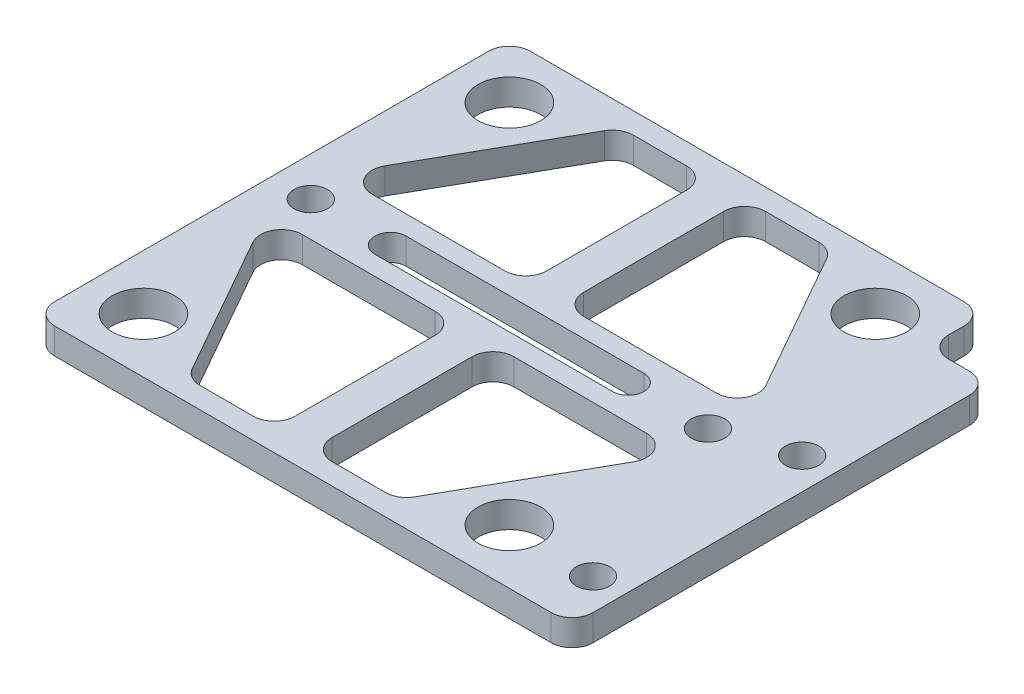
from build123d import *

# Parameters (mm, degrees)
SKETCH_1_W          = 45.5
SKETCH_1_H          = 45.5
SKETCH_1_R          = 3
EXTRUDE_1_DEPTH     = 2.5
SKETCH_2_W          = 6
SKETCH_2_H          = 40
SKETCH_2_R          = 1.6
EXTRUDE_2_DEPTH     = 2.5
FILLET_1_R          = 2
CUT_EXTRUDE_1_DEPTH = 37.747448891
FILLET_2_R          = 2
SKETCH_4_R          = 1.6
CUT_EXTRUDE_2_DEPTH = 37.747448891


with BuildPart() as part:
    # 草图1 → 凸台-拉伸1 (new body)
    with BuildSketch(Plane(origin=(0, 0, 0), x_dir=(1, 0, 0), z_dir=(0, 1, 0))):
        Rectangle(SKETCH_1_W, SKETCH_1_H)
        with Locations(Location((17.5, 17.5, 0), (0, 0, 270))):
            Circle(SKETCH_1_R, mode=Mode.SUBTRACT)
        with Locations(Location((17.5, -17.5, 0), (0, 0, 270))):
            Circle(SKETCH_1_R, mode=Mode.SUBTRACT)
        with Locations(Location((-17.5, -17.5, 0), (0, 0, 90))):
            Circle(SKETCH_1_R, mode=Mode.SUBTRACT)
        with Locations(Location((-17.5, 17.5, 0), (0, 0, 90))):
            Circle(SKETCH_1_R, mode=Mode.SUBTRACT)
    extrude(amount=EXTRUDE_1_DEPTH)

    # 草图2 → 凸台-拉伸2 (add)
    with BuildSketch(Plane(origin=(0, 2.5, 0), x_dir=(1, 0, 0), z_dir=(0, 1, 0))):
        with Locations((25.75, -2.75)):
            Rectangle(SKETCH_2_W, SKETCH_2_H)
        with Locations(Location((25.75, -17.75, 0), (0, 0, 270))):
            Circle(SKETCH_2_R, mode=Mode.SUBTRACT)
        with Locations(Location((25.75, 2.25, 0), (0, 0, 270))):
            Circle(SKETCH_2_R, mode=Mode.SUBTRACT)
    extrude(amount=-EXTRUDE_2_DEPTH)

    # 圆角1
    fillet_1_edges = [part.edges().sort_by_distance(p)[0] for p in [
        (28.75, 1.25, -17.25),
        (22.75, 1.25, -17.25),
        (28.75, 1.25, 22.75),
        (-22.75, 1.25, 22.75),
        (-22.75, 1.25, -22.75),
        (22.75, 1.25, -22.75),
    ]]
    fillet(fillet_1_edges, radius=FILLET_1_R)

    # 草图3 → 切除-拉伸1 (cut, through all)
    with BuildSketch(Plane(origin=(0, 2.5, 0), x_dir=(1, 0, 0), z_dir=(0, 1, 0))):
        Polygon((-10.045962714, 20.729282101), (-19.893887011, 3.33704153), (-1.766794069, 3.33704153), (-1.766794069, 20.729282101), align=None)
        Polygon((1.766794069, 3.33704153), (1.766794069, 20.729282101), (10.045962714, 20.729282101), (19.893887011, 3.33704153), align=None)
        Polygon((19.893887011, -3.33704153), (1.766794069, -3.33704153), (1.766794069, -20.729282101), (10.045962714, -20.729282101), align=None)
        Polygon((-1.766794069, -3.33704153), (-1.766794069, -20.729282101), (-10.045962714, -20.729282101), (-19.893887011, -3.33704153), align=None)
        with BuildLine():
            Line((-11.375, 1.5), (11.375, 1.5))
            ThreePointArc((11.375, 1.5), (12.875, 0), (11.375, -1.5))
            Line((11.375, -1.5), (-11.375, -1.5))
            ThreePointArc((-11.375, -1.5), (-12.875, 0), (-11.375, 1.5))
        make_face()
    extrude(amount=-CUT_EXTRUDE_1_DEPTH, mode=Mode.SUBTRACT)

    # 圆角2
    fillet_2_edges = [part.edges().sort_by_distance(p)[0] for p in [
        (19.893887011, 1.25, -3.33704153),
        (1.766794069, 1.25, -3.33704153),
        (1.766794069, 1.25, -20.729282101),
        (10.045962714, 1.25, -20.729282101),
        (19.893887011, 1.25, 3.33704153),
        (10.045962714, 1.25, 20.729282101),
        (1.766794069, 1.25, 20.729282101),
        (1.766794069, 1.25, 3.33704153),
        (-19.893887011, 1.25, 3.33704153),
        (-1.766794069, 1.25, 3.33704153),
        (-1.766794069, 1.25, 20.729282101),
        (-10.045962714, 1.25, 20.729282101),
        (-10.045962714, 1.25, -20.729282101),
        (-1.766794069, 1.25, -20.729282101),
        (-1.766794069, 1.25, -3.33704153),
        (-19.893887011, 1.25, -3.33704153),
    ]]
    fillet(fillet_2_edges, radius=FILLET_2_R)

    # 草图4 → 切除-拉伸2 (cut, through all)
    with BuildSketch(Plane(origin=(0, 2.5, 0), x_dir=(1, 0, 0), z_dir=(0, 1, 0))):
        with Locations(Location((-19, 0, 0), (0, 0, 270))):
            Circle(SKETCH_4_R)
        with Locations(Location((19, 0, 0), (0, 0, 90))):
            Circle(SKETCH_4_R)
    extrude(amount=-CUT_EXTRUDE_2_DEPTH, mode=Mode.SUBTRACT)


solid = part.part
